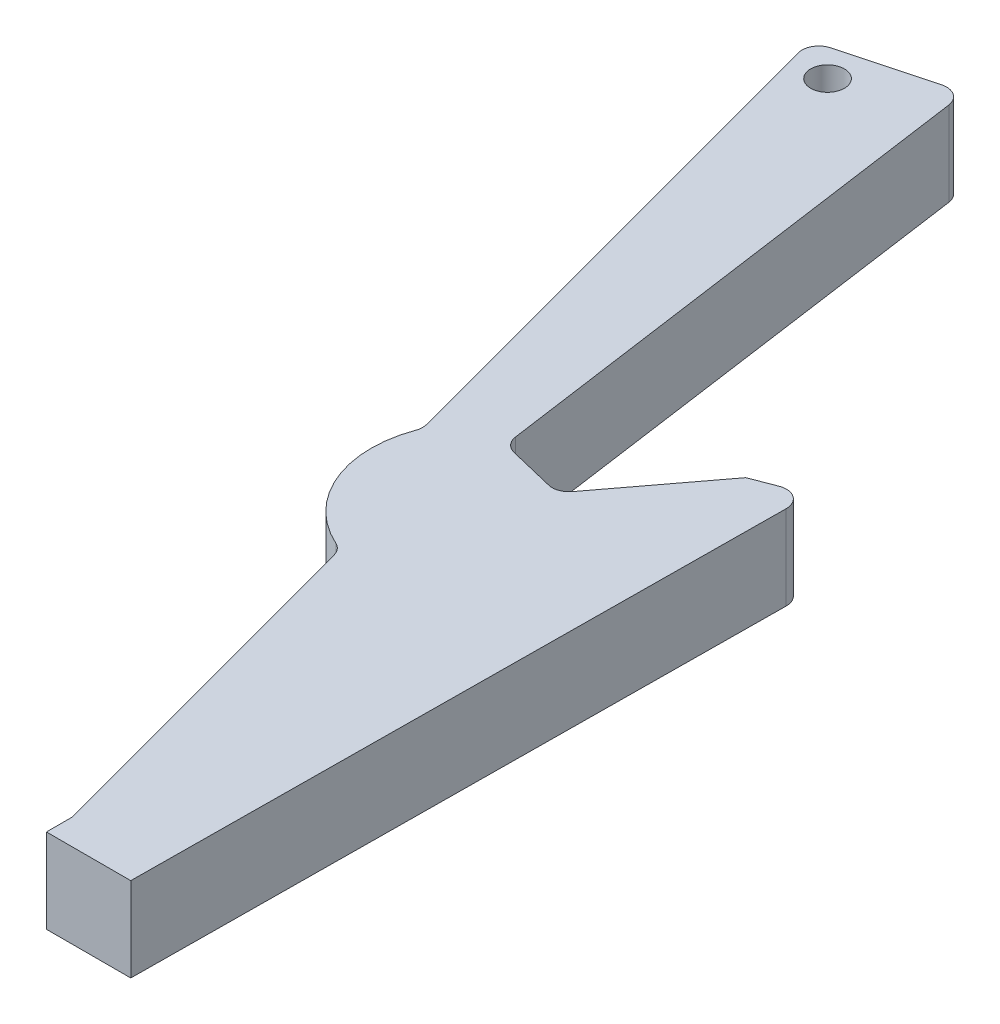
from build123d import *

# Parameters (mm, degrees)
BOSS_EXTRUDE1_DEPTH = 10
SKETCH2_R           = 2
CUT_EXTRUDE1_DEPTH  = 95.069255763
FILLET2_R           = 2


with BuildPart() as part:
    # Sketch1 → Boss-Extrude1 (new body)
    with BuildSketch(Plane(origin=(0, 0, 0), x_dir=(1, 0, 0), z_dir=(0, 1, 0))):
        with BuildLine():
            Line((4.490285151, 86.059065801), (-9.998602244, 82.176780125))
            Line((-9.998602244, 82.176780125), (6.824635688, 19.391601416))
            ThreePointArc((6.824635688, 19.391601416), (6.870412184, 9.156856882), (14.309200004, 2.127167918))
            Line((14.309200004, 2.127167918), (25.956057034, -41.339494265))
            Line((25.956057034, -41.339494265), (25.956057034, -44.339494265))
            Line((25.956057034, -44.339494265), (35.956057034, -44.339494265))
            Line((35.956057034, -44.339494265), (36.645082525, 35.660505735))
            Line((36.645082525, 35.660505735), (31.040771516, 33.517680938))
            Line((31.040771516, 33.517680938), (21.397363612, 20.750352164))
            Line((21.397363612, 20.750352164), (13.397363612, 22.681909402))
            Line((13.397363612, 22.681909402), (4.490285151, 86.059065801))
        make_face()
    extrude(amount=BOSS_EXTRUDE1_DEPTH)

    # Sketch2 → Cut-Extrude1 (cut, through all)
    with BuildSketch(Plane(origin=(0, 10, 0), x_dir=(1, 0, 0), z_dir=(0, 1, 0))):
        with Locations(Location((-5.099622758, 79.348353, 0), (0, 0, 270))):
            Circle(SKETCH2_R)
    extrude(amount=-CUT_EXTRUDE1_DEPTH, mode=Mode.SUBTRACT)

    # Fillet2
    fillet2_edges = [part.edges().sort_by_distance(p)[0] for p in [
        (13.397363612, 5, -22.681909402),
        (21.397363612, 5, -20.750352164),
        (36.645082525, 5, -35.660505735),
        (14.309200004, 5, -2.127167918),
        (6.824635688, 5, -19.391601416),
        (-9.998602244, 5, -82.176780125),
        (4.490285151, 5, -86.059065801),
    ]]
    fillet(fillet2_edges, radius=FILLET2_R)


solid = part.part
